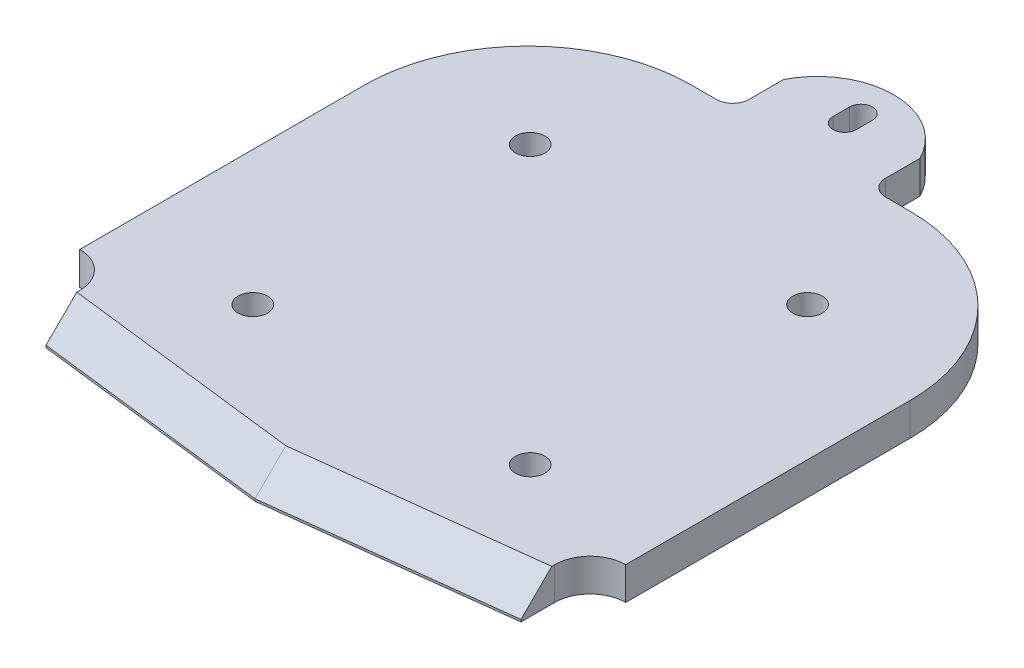
from build123d import *

# Parameters (mm, degrees)
BOSS_EXTRUDE1_DEPTH     = 6
CUT_EXTRUDE1_DEPTH      = 43.812285079
CUT_EXTRUDE2_DEPTH      = 43.812285079
F_1_4_28_TAPPED_HOLE1_D = 5.4102


with BuildPart() as part:
    # Sketch1 → Boss-Extrude1 (new body)
    with BuildSketch(Plane(origin=(0, 0, 0), x_dir=(1, 0, 0), z_dir=(0, 1, 0))):
        with BuildLine():
            ThreePointArc((-43.5, 11.4), (-45.403805922, 15.996194078), (-50, 17.9))
            Line((-50, 17.9), (-50, 70))
            ThreePointArc((-50, 70), (-41.213203436, 91.213203436), (-20, 100))
            Line((-20, 100), (-15.5, 100))
            ThreePointArc((-15.5, 100), (-13.378679656, 100.878679656), (-12.5, 103))
            Line((-12.5, 103), (-12.5, 109.304760106))
            ThreePointArc((-12.5, 109.304760106), (0, 117), (12.5, 109.304760106))
            Line((12.5, 109.304760106), (12.5, 103))
            ThreePointArc((12.5, 103), (13.378679656, 100.878679656), (15.5, 100))
            Line((15.5, 100), (20, 100))
            ThreePointArc((20, 100), (41.213203436, 91.213203436), (50, 70))
            Line((50, 70), (50, 17.9))
            ThreePointArc((50, 17.9), (45.403805922, 15.996194078), (43.5, 11.4))
            Line((43.5, 11.4), (43.5, 5.221716559))
            Line((43.5, 5.221716559), (0, 0))
            Line((0, 0), (-43.5, 5.221716559))
            Line((-43.5, 5.221716559), (-43.5, 11.4))
        make_face()
        with BuildLine():
            ThreePointArc((2.1, 111), (0, 113.1), (-2.1, 111))
            Line((-2.1, 111), (-2.1, 108))
            ThreePointArc((-2.1, 108), (0, 105.9), (2.1, 108))
            Line((2.1, 108), (2.1, 111))
        make_face(mode=Mode.SUBTRACT)
    extrude(amount=BOSS_EXTRUDE1_DEPTH)

    # Sketch2 → Cut-Extrude1 (cut, along a direction that is not the sketch's normal)
    with BuildSketch(Plane(origin=(0, 0, 0), x_dir=(0, 0, -1), z_dir=(1, 0, 0))):
        Polygon((5.640200242, 6), (0, 0.400000131), (0, 6), align=None)
    extrude(amount=CUT_EXTRUDE1_DEPTH, dir=(0.9928722028940861, 0, -0.11918384420820177), mode=Mode.SUBTRACT)

    # Sketch2<2> → Cut-Extrude2 (cut, along a direction that is not the sketch's normal)
    with BuildSketch(Plane(origin=(0, 0, 0), x_dir=(0, 0, -1), z_dir=(1, 0, 0))):
        Polygon((5.640200242, 6), (0, 0.400000131), (0, 6), align=None)
    extrude(amount=-CUT_EXTRUDE2_DEPTH, dir=(0.9928722028940861, 0, 0.11918384420820147), mode=Mode.SUBTRACT)

    # 1/4-28 Tapped Hole1 (through all)
    with Locations(Plane(origin=(0, 6, 0), x_dir=(1, 0, 0), z_dir=(0, 1, 0))):
        with Locations((-25.4, 75.8), (25.4, 75.8), (25.4, 25), (-25.4, 25)):
            Hole(F_1_4_28_TAPPED_HOLE1_D / 2)


solid = part.part
